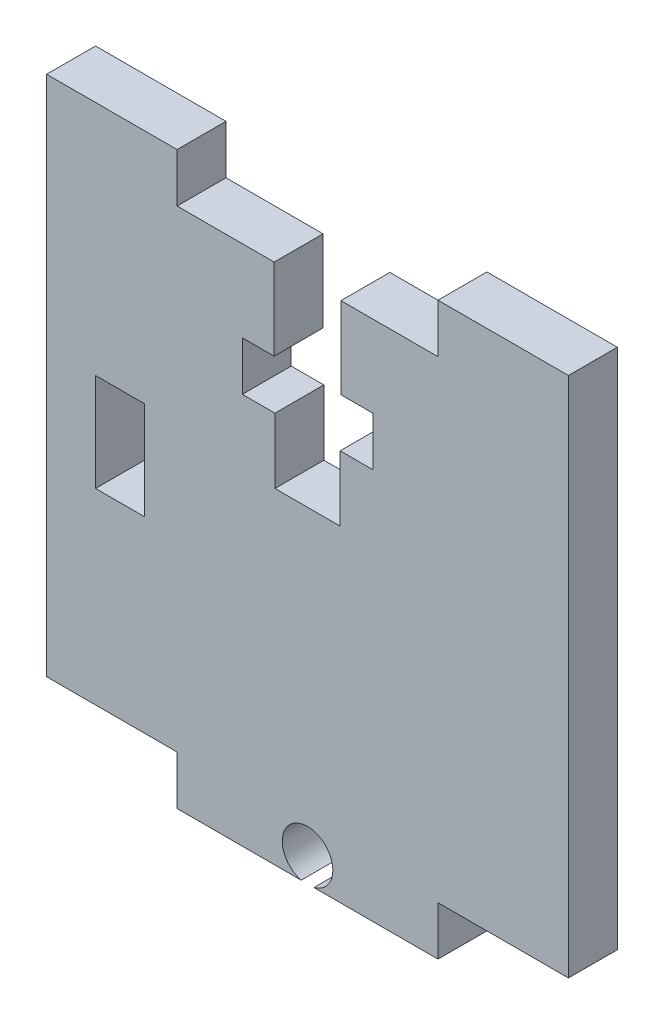
from build123d import *

# Parameters (mm, degrees)
SKETCH_2_W      = 3
SKETCH_2_H      = 6
EXTRUDE_1_DEPTH = 3


with BuildPart() as part:
    # 草图2 → 凸台-拉伸1 (new body)
    with BuildSketch(Plane.XY):
        with BuildLine():
            Line((2.047890023, 48.855305477), (8, 48.855305477))
            Line((8, 48.855305477), (8, 51.855305477))
            Line((8, 51.855305477), (16, 51.855305477))
            Line((16, 51.855305477), (16, 19.855305477))
            Line((16, 19.855305477), (8, 19.855305477))
            Line((8, 19.855305477), (8, 16.855305477))
            Line((8, 16.855305477), (0.390512484, 16.855305477))
            ThreePointArc((0.390512484, 16.855305477), (0, 19.905305477), (-0.390512484, 16.855305477))
            Line((-0.390512484, 16.855305477), (-8, 16.855305477))
            Line((-8, 16.855305477), (-8, 19.855305477))
            Line((-8, 19.855305477), (-16, 19.855305477))
            Line((-16, 19.855305477), (-16, 51.855305477))
            Line((-16, 51.855305477), (-8, 51.855305477))
            Line((-8, 51.855305477), (-8, 48.855305477))
            Line((-8, 48.855305477), (-2.047890023, 48.855305477))
            Line((-2.047890023, 48.855305477), (-2.047890023, 43.855305477))
            Line((-2.047890023, 43.855305477), (-4, 43.855305477))
            Line((-4, 43.855305477), (-4, 40.855305477))
            Line((-4, 40.855305477), (-2, 40.855305477))
            Line((-2, 40.855305477), (-2, 36.855305477))
            Line((-2, 36.855305477), (2, 36.855305477))
            Line((2, 36.855305477), (2, 40.855305477))
            Line((2, 40.855305477), (4, 40.855305477))
            Line((4, 40.855305477), (4, 43.855305477))
            Line((4, 43.855305477), (2.047890023, 43.855305477))
            Line((2.047890023, 43.855305477), (2.047890023, 48.855305477))
        make_face()
        with Locations((-11.5, 34.355305477)):
            Rectangle(SKETCH_2_W, SKETCH_2_H, mode=Mode.SUBTRACT)
    extrude(amount=EXTRUDE_1_DEPTH)


solid = part.part
